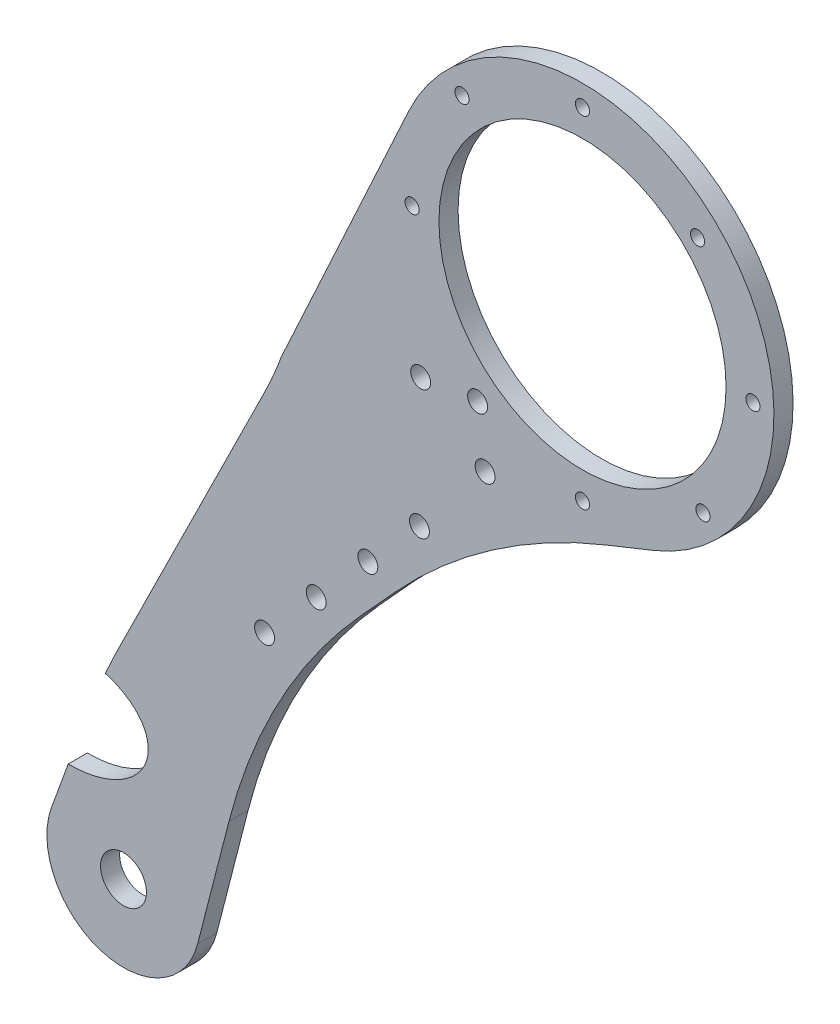
from build123d import *
from build123d.topology import SkipClean

# Parameters (mm, degrees)
SKETCH_2_R           = 1.85
SKETCH_2_R_2         = 6
SKETCH_2_R_3         = 2.6
SKETCH_2_R_4         = 40
EXTRUDE_1_DEPTH      = 5
SKETCH_4_R           = 2.6
CUT_EXTRUDE_3_DEPTH  = 169.423393932
CUT_EXTRUDE_4_DEPTH  = 10
SKETCH_6_R           = 1.85
CUT_EXTRUDE_5_DEPTH  = 10
CUT_EXTRUDE_START    = -10
SKETCH_7_R           = 2.6
CUT_EXTRUDE_6_DEPTH  = 10
EXTRUDE_START        = -5
SKETCH_9_R           = 40
SKETCH_9_R_2         = 35
EXTRUDE_2_DEPTH      = 5
CUT_EXTRUDE_START_2  = -6
SKETCH_10_R          = 37.5
SKETCH_10_R_2        = 35
CUT_EXTRUDE_7_DEPTH  = 6
SKETCH_11_R          = 2.6
CUT_EXTRUDE_8_DEPTH  = 10
CUT_EXTRUDE_9_DEPTH  = 10
CUT_EXTRUDE_10_DEPTH = 10
FILLET_1_R           = 150
EXTRUDE_3_DEPTH      = 5


with BuildPart() as part:
    # 草图2 → 凸台-拉伸1 (new body)
    with BuildSketch(Plane.XY):
        with BuildLine():
            Line((46.156903962, 11.726240368), (53.803397884, 15.224929341))
            ThreePointArc((53.803397884, 15.224929341), (58.326658301, 17.467503151), (62.957338012, 19.4789274))
            ThreePointArc((62.957338012, 19.4789274), (77.29006981, 122.455437348), (-18.996338104, 83.231510302))
            ThreePointArc((-18.996338104, 83.231510302), (-20.999703159, 72.772813391), (-24.103859546, 62.586448693))
            Line((-24.103859546, 62.586448693), (-38.175863902, 23.923934481))
            ThreePointArc((-38.175863902, 23.923934481), (-40.212568483, 18.776172804), (-42.531024435, 13.749008808))
            Line((-42.531024435, 13.749008808), (-80.478136278, -62.880797881))
            ThreePointArc((-80.478136278, -62.880797881), (-82.357205698, -66.780945834), (-84.151417051, -70.720852122))
            add(Edge.make_bspline(
                [(-93.856776054, -96.056749466), (-77.676549837, -96.295826901), (-73.59121439, -85.631034443), (-69.505878943, -74.966241984), (-84.151417051, -70.720852122)],
                knots=[1.469085418, 1.469085418, 1.469085418, 2.850930512, 2.850930512, 4.232775606, 4.232775606, 4.232775606], degree=2, weights=[1, 0.770658452, 1, 0.770658452, 1]))
            Line((-93.856776054, -96.056749466), (-98.222987341, -108.052816384))
            ThreePointArc((-98.222987341, -108.052816384), (-86.77004783, -133.497277887), (-61.028196713, -122.729383678))
            Line((-61.028196713, -122.729383678), (-40.849387976, -75.345358468))
            ThreePointArc((-40.849387976, -75.345358468), (-30.051381731, -53.717906992), (-16.72300153, -33.551155211))
            ThreePointArc((-16.72300153, -33.551155211), (12.503286633, -7.838185635), (46.156903962, 11.726240368))
        make_face()
        with Locations((84.949732008, 75.097338668)):
            Circle(SKETCH_2_R, mode=Mode.SUBTRACT)
        with Locations((-4.050267992, 75.097338668)):
            Circle(SKETCH_2_R, mode=Mode.SUBTRACT)
        with Locations((71.915983771, 43.631086905)):
            Circle(SKETCH_2_R, mode=Mode.SUBTRACT)
        with Locations((-79.429134925, -114.893219251)):
            Circle(SKETCH_2_R_2, mode=Mode.SUBTRACT)
        with Locations((40.449732008, 30.597338668)):
            Circle(SKETCH_2_R, mode=Mode.SUBTRACT)
        with Locations((8.983480246, 106.56359043)):
            Circle(SKETCH_2_R, mode=Mode.SUBTRACT)
        with Locations((40.449732008, 119.597338668)):
            Circle(SKETCH_2_R, mode=Mode.SUBTRACT)
        with Locations((91.263106296, 96.144927448)):
            Circle(SKETCH_2_R_3, mode=Mode.SUBTRACT)
        with Locations((61.497320788, 125.910712956)):
            Circle(SKETCH_2_R_3, mode=Mode.SUBTRACT)
        with Locations((19.402143228, 125.910712956)):
            Circle(SKETCH_2_R_3, mode=Mode.SUBTRACT)
        with Locations((-10.36364228, 96.144927448)):
            Circle(SKETCH_2_R_3, mode=Mode.SUBTRACT)
        with Locations((61.497320788, 24.28396438)):
            Circle(SKETCH_2_R_3, mode=Mode.SUBTRACT)
        with Locations((91.263106296, 54.049749888)):
            Circle(SKETCH_2_R_3, mode=Mode.SUBTRACT)
        with Locations((40.449732008, 75.097338668)):
            Circle(SKETCH_2_R_4, mode=Mode.SUBTRACT)
    extrude(amount=EXTRUDE_1_DEPTH)

    # 草图4 → 切除-拉伸3 (cut, through all)
    with BuildSketch(Plane.XY.offset(5)):
        with Locations((15.013360586, 24.524765434)):
            Circle(SKETCH_4_R)
        with Locations((-1.816205218, 37.438545471)):
            Circle(SKETCH_4_R)
    extrude(amount=-CUT_EXTRUDE_3_DEPTH, mode=Mode.SUBTRACT)

    # 草图5 → 切除-拉伸4 (cut)
    with BuildSketch(Plane.XY.offset(5)):
        with BuildLine():
            Line((-8.423467612, 16.05398749), (-20.121091317, 24.535530938))
            ThreePointArc((-20.121091317, 24.535530938), (-24.253464543, 25.342120702), (-27.536808054, 22.706451734))
            Line((-27.536808054, 22.706451734), (-60.02565112, -42.90101199))
            ThreePointArc((-60.02565112, -42.90101199), (-59.362421415, -45.43938114), (-56.756320843, -45.137004897))
            Line((-56.756320843, -45.137004897), (-7.665858657, 8.634926019))
            ThreePointArc((-7.665858657, 8.634926019), (-6.384346617, 12.514002548), (-8.423467612, 16.05398749))
        make_face()
    extrude(amount=-CUT_EXTRUDE_4_DEPTH, mode=Mode.SUBTRACT)

    # 草图6 → 切除-拉伸5 (cut)
    with BuildSketch(Plane.XY.offset(5)):
        with Locations((70.501770209, 105.149376868)):
            Circle(SKETCH_6_R)
    extrude(amount=-CUT_EXTRUDE_5_DEPTH, mode=Mode.SUBTRACT)

    # 草图7 → 切除-拉伸6 (cut)
    with BuildSketch(Plane.XY.offset(5).offset(CUT_EXTRUDE_START)):
        with BuildLine():
            Line((-24.103859546, 62.586448693), (-38.175863902, 23.923934481))
            Line((-38.175863902, 23.923934481), (-4.962948377, 96.018343908))
            ThreePointArc((-4.962948377, 96.018343908), (51.158746453, 123.937045972), (90.449732008, 75.097338668))
            ThreePointArc((90.449732008, 75.097338668), (85.105744991, 52.606440408), (70.216111828, 34.923184882))
            Line((70.216111828, 34.923184882), (12.503286633, -7.838185635))
            ThreePointArc((12.503286633, -7.838185635), (28.852969298, 2.764752483), (46.156903962, 11.726240368))
            Line((46.156903962, 11.726240368), (53.803397884, 15.224929341))
            ThreePointArc((53.803397884, 15.224929341), (58.326658301, 17.467503151), (62.957338012, 19.4789274))
            ThreePointArc((62.957338012, 19.4789274), (77.29006981, 122.455437348), (-18.996338104, 83.231510302))
            ThreePointArc((-18.996338104, 83.231510302), (-20.999703159, 72.772813391), (-24.103859546, 62.586448693))
        make_face()
        with Locations((-10.36364228, 96.144927448)):
            Circle(SKETCH_7_R, mode=Mode.SUBTRACT)
        with Locations((61.497320788, 24.28396438)):
            Circle(SKETCH_7_R, mode=Mode.SUBTRACT)
        with Locations((91.263106296, 54.049749888)):
            Circle(SKETCH_7_R, mode=Mode.SUBTRACT)
        with Locations((19.402143228, 125.910712956)):
            Circle(SKETCH_7_R, mode=Mode.SUBTRACT)
        with Locations((91.263106296, 96.144927448)):
            Circle(SKETCH_7_R, mode=Mode.SUBTRACT)
        with Locations((61.497320788, 125.910712956)):
            Circle(SKETCH_7_R, mode=Mode.SUBTRACT)
    extrude(amount=CUT_EXTRUDE_6_DEPTH, mode=Mode.SUBTRACT)

    # 草图9 → 凸台-拉伸2 (add)
    with BuildSketch(Plane.XY.offset(5).offset(EXTRUDE_START)):
        with Locations((40.449732008, 75.097338668)):
            Circle(SKETCH_9_R)
        with Locations((40.449732008, 75.097338668)):
            Circle(SKETCH_9_R_2, mode=Mode.SUBTRACT)
    extrude(amount=EXTRUDE_2_DEPTH)

    # 草图10 → 切除-拉伸7 (cut)
    with BuildSketch(Plane.XY.offset(5).offset(CUT_EXTRUDE_START_2)):
        with Locations((40.449732008, 75.097338668)):
            Circle(SKETCH_10_R)
        with Locations((40.449732008, 75.097338668)):
            Circle(SKETCH_10_R_2, mode=Mode.SUBTRACT)
    extrude(amount=CUT_EXTRUDE_7_DEPTH, mode=Mode.SUBTRACT)

    # 草图11 → 切除-拉伸8 (cut)
    with BuildSketch(Plane.XY.offset(5)):
        with Locations((-2.126927733, 3.578223118)):
            Circle(SKETCH_11_R)
        with Locations((-15.611468802, -11.192259344)):
            Circle(SKETCH_11_R)
        with Locations((-29.096009871, -25.962741806)):
            Circle(SKETCH_11_R)
        with Locations((-42.58055094, -40.733224268)):
            Circle(SKETCH_11_R)
    extrude(amount=-CUT_EXTRUDE_8_DEPTH, mode=Mode.SUBTRACT)

    # 草图13 → 切除-拉伸9 (cut)
    with BuildSketch(Plane.XY.offset(5)):
        with BuildLine():
            Line((13.055467703, 39.396438355), (10.477711063, 39.057070255))
            ThreePointArc((10.477711063, 39.057070255), (10.803801653, 38.096438355), (11.472687988, 37.33371967))
            Line((11.472687988, 37.33371967), (13.055467703, 39.396438355))
        make_face()
        with BuildLine():
            Line((13.055467703, 39.396438355), (11.472687988, 37.33371967))
            ThreePointArc((11.472687988, 37.33371967), (12.382538186, 36.885031206), (13.394835803, 36.818681715))
            Line((13.394835803, 36.818681715), (13.055467703, 39.396438355))
        make_face()
        with BuildLine():
            ThreePointArc((15.655467703, 39.396438355), (12.885419567, 41.990871555), (10.477711063, 39.057070255))
            Line((10.477711063, 39.057070255), (13.055467703, 39.396438355))
            Line((13.055467703, 39.396438355), (13.394835803, 36.818681715))
            ThreePointArc((13.394835803, 36.818681715), (15.010251202, 37.682139235), (15.655467703, 39.396438355))
        make_face()
    extrude(amount=-CUT_EXTRUDE_9_DEPTH, mode=Mode.SUBTRACT)

    # 草图14 → 切除-拉伸10 (cut)
    with SkipClean():  # the faces are left unmerged after this step: merging them gives an invalid solid
        with BuildSketch(Plane.XY.offset(5).offset(CUT_EXTRUDE_START)):
            with BuildLine():
                Line((14.728748603, 10.917477098), (-42.58055094, -51.857073366))
                Line((-42.58055094, -51.857073366), (-60.058496736, -119.87100753))
                ThreePointArc((-60.058496736, -119.87100753), (-60.489346793, -121.318515003), (-61.028196713, -122.729383678))
                Line((-61.028196713, -122.729383678), (-40.849387976, -75.345358468))
                ThreePointArc((-40.849387976, -75.345358468), (-30.051381731, -53.717906992), (-16.72300153, -33.551155211))
                ThreePointArc((-16.72300153, -33.551155211), (-2.736930602, -19.981916471), (12.503286633, -7.838185635))
                Line((12.503286633, -7.838185635), (70.216111828, 34.923184882))
                ThreePointArc((70.216111828, 34.923184882), (64.835772841, 31.447355706), (59.055215652, 28.687900205))
                Line((59.055215652, 28.687900205), (14.728748603, 10.917477098))
            make_face()
        extrude(amount=CUT_EXTRUDE_10_DEPTH, mode=Mode.SUBTRACT)

    # 圆角1
    fillet_1_edges = [part.edges().sort_by_distance(p)[0] for p in [
        (-42.58055094, -51.857073366, 2.5),
        (14.728748603, 10.917477098, 2.5),
    ]]
    fillet(fillet_1_edges, radius=FILLET_1_R)

    # 草图15 → 凸台-拉伸3 (add, through all)
    with SkipClean():  # the faces are left unmerged after this step: merging them gives an invalid solid
        with BuildSketch(Plane.XY.offset(5)):
            with BuildLine():
                Line((-27.536808054, 22.706451734), (-60.02565112, -42.90101199))
                ThreePointArc((-60.02565112, -42.90101199), (-59.362421415, -45.43938114), (-56.756320843, -45.137004897))
                Line((-56.756320843, -45.137004897), (-7.665858657, 8.634926019))
                ThreePointArc((-7.665858657, 8.634926019), (-6.384346617, 12.514002548), (-8.423467612, 16.05398749))
                Line((-8.423467612, 16.05398749), (-20.121091317, 24.535530938))
                ThreePointArc((-20.121091317, 24.535530938), (-24.253464543, 25.342120702), (-27.536808054, 22.706451734))
            make_face()
        extrude(amount=-EXTRUDE_3_DEPTH)


solid = part.part
